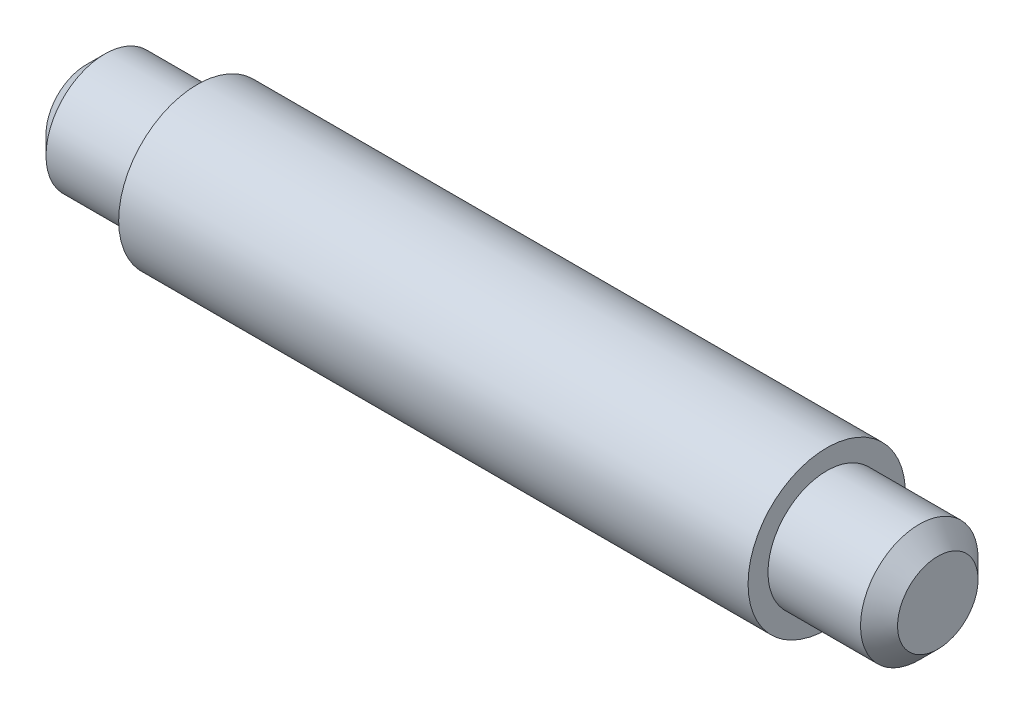
from build123d import *


with BuildPart() as part:
    # Sketch2 → Revolve3 (revolve)
    with BuildSketch(Plane.XY, mode=Mode.PRIVATE) as revolve3_sk:
        Polygon((0, 0), (46, 0), (46, 2.175), (45, 3.175), (40, 3.175), (40, 4.25), (6, 4.25), (6, 3.175), (1, 3.175), (0, 2.175), align=None)
    revolve(revolve3_sk.sketch.rotate(Axis((0, 0, 0), (1, 0, 0)), 90), axis=Axis((0, 0, 0), (1, 0, 0)))


solid = part.part
